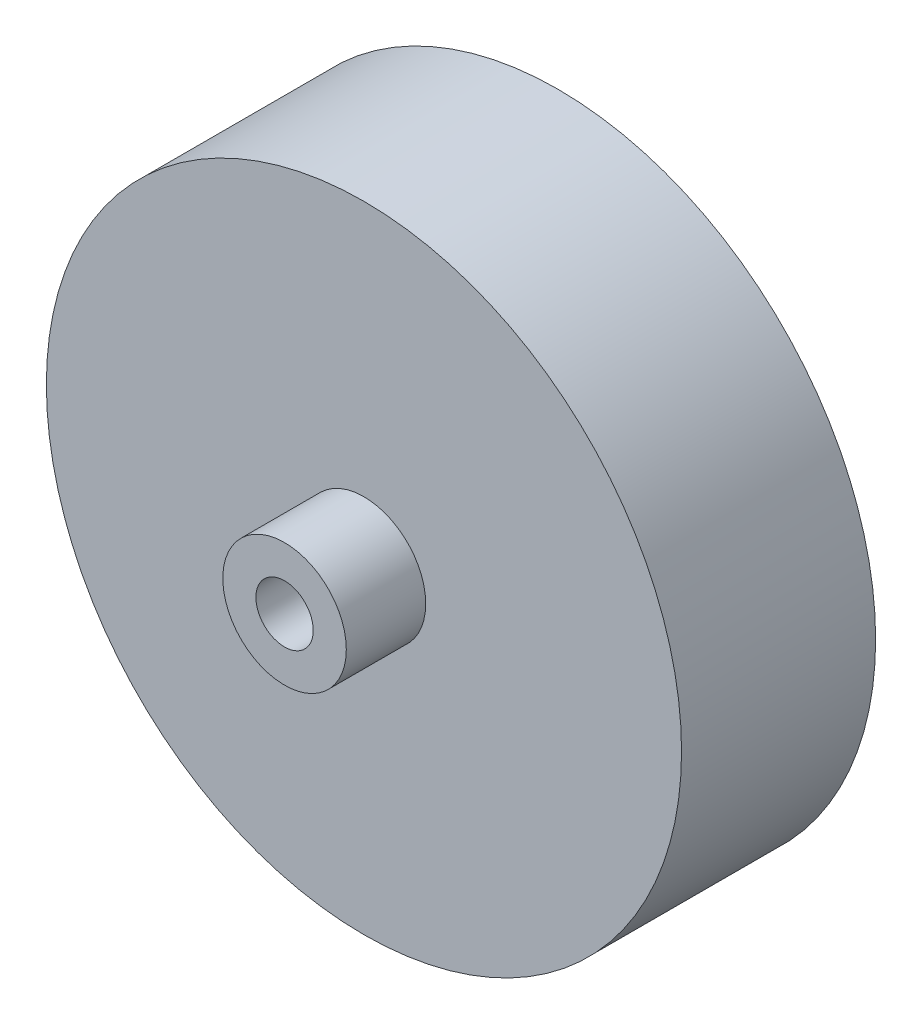
from build123d import *

# Parameters (mm, degrees)
SKETCH1_R           = 36
BOSS_EXTRUDE1_DEPTH = 22
SKETCH2_R           = 7
BOSS_EXTRUDE2_DEPTH = 9
SKETCH3_R           = 3.25
CUT_EXTRUDE1_DEPTH  = 31


with BuildPart() as part:
    # Sketch1 → Boss-Extrude1 (new body)
    with BuildSketch(Plane.XY):
        Circle(SKETCH1_R)
    extrude(amount=BOSS_EXTRUDE1_DEPTH)

    # Sketch2 → Boss-Extrude2 (add)
    with BuildSketch(Plane.XY.offset(22)):
        Circle(SKETCH2_R)
    extrude(amount=BOSS_EXTRUDE2_DEPTH)

    # Sketch3 → Cut-Extrude1 (cut)
    with BuildSketch(Plane.XY.offset(31)):
        Circle(SKETCH3_R)
    extrude(amount=-CUT_EXTRUDE1_DEPTH, mode=Mode.SUBTRACT)


solid = part.part
